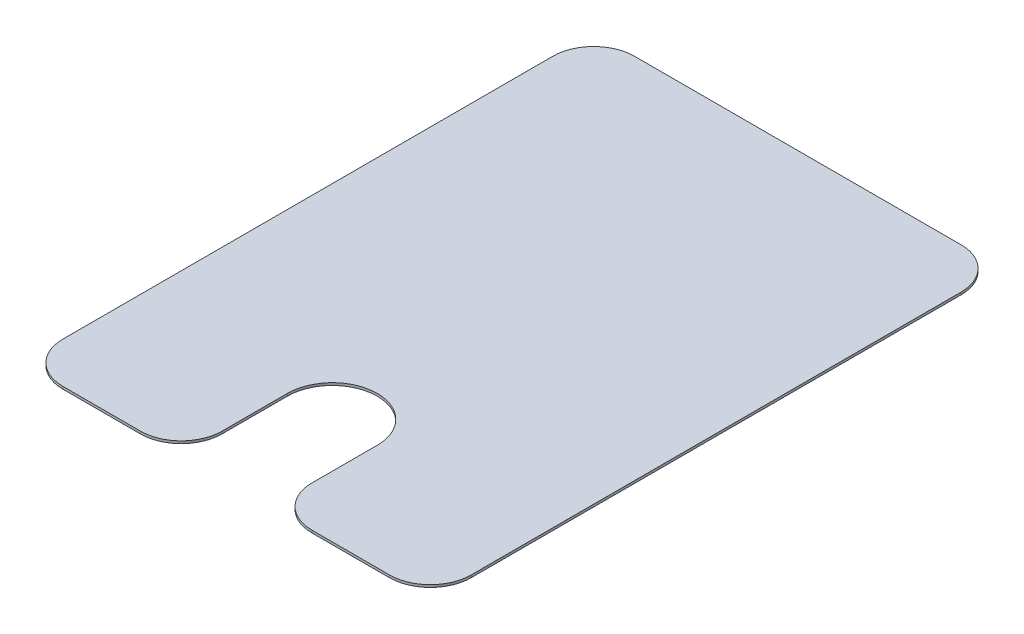
from build123d import *

# Parameters (mm, degrees)
EXTRUDE_1_DEPTH = 3


with BuildPart() as part:
    # 草图1 → 凸台-拉伸1 (new body)
    with BuildSketch(Plane(origin=(0, 0, 0), x_dir=(1, 0, 0), z_dir=(0, 1, 0))):
        with BuildLine():
            Line((-55, -220), (-55, -300))
            ThreePointArc((-55, -300), (-69.644660941, -335.355339059), (-105, -350))
            Line((-105, -350), (-200, -350))
            ThreePointArc((-200, -350), (-235.355339059, -335.355339059), (-250, -300))
            Line((-250, -300), (-250, 300))
            ThreePointArc((-250, 300), (-235.355339059, 335.355339059), (-200, 350))
            Line((-200, 350), (200, 350))
            ThreePointArc((200, 350), (235.355339059, 335.355339059), (250, 300))
            Line((250, 300), (250, -300))
            ThreePointArc((250, -300), (235.355339059, -335.355339059), (200, -350))
            Line((200, -350), (105, -350))
            ThreePointArc((105, -350), (69.644660941, -335.355339059), (55, -300))
            Line((55, -300), (55, -220))
            ThreePointArc((55, -220), (0, -165), (-55, -220))
        make_face()
    extrude(amount=EXTRUDE_1_DEPTH)


solid = part.part
